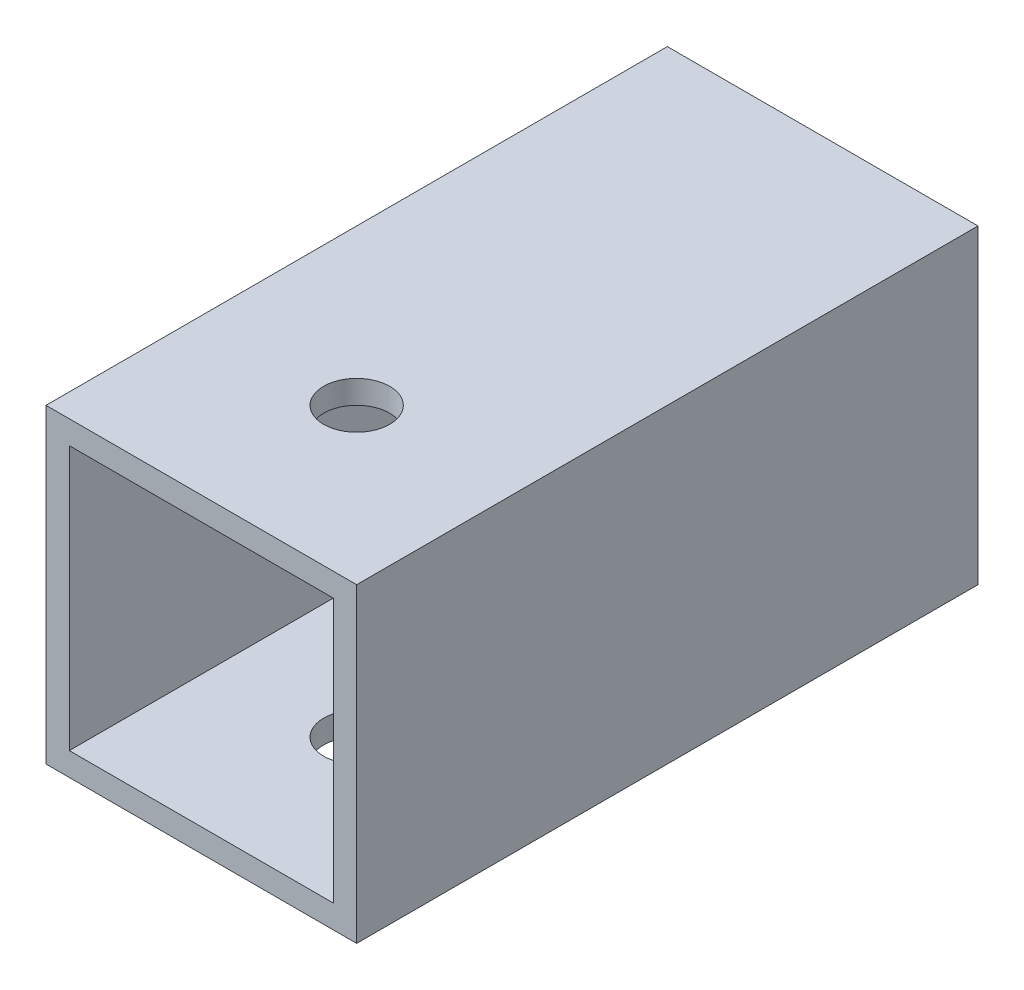
from build123d import *

# Parameters (mm, degrees)
SKETCH1_W           = 20
SKETCH1_H           = 20
SKETCH1_W_2         = 17
SKETCH1_H_2         = 17
BOSS_EXTRUDE1_DEPTH = 40
SKETCH2_R           = 2.125
CUT_EXTRUDE1_DEPTH  = 46.82575695


with BuildPart() as part:
    # Sketch1 → Boss-Extrude1 (new body)
    with BuildSketch(Plane.XY):
        Rectangle(SKETCH1_W, SKETCH1_H)
        Rectangle(SKETCH1_W_2, SKETCH1_H_2, mode=Mode.SUBTRACT)
    extrude(amount=-BOSS_EXTRUDE1_DEPTH)

    # Sketch2 → Cut-Extrude1 (cut, through all)
    with BuildSketch(Plane(origin=(0, 10, 0), x_dir=(1, 0, 0), z_dir=(0, 1, 0))):
        with Locations(Location((0, 10, 0), (0, 0, 270))):
            Circle(SKETCH2_R)
        with Locations((0, 80)):
            Circle(SKETCH2_R)
        with Locations((0, 150)):
            Circle(SKETCH2_R)
    extrude(amount=-CUT_EXTRUDE1_DEPTH, mode=Mode.SUBTRACT)


solid = part.part
